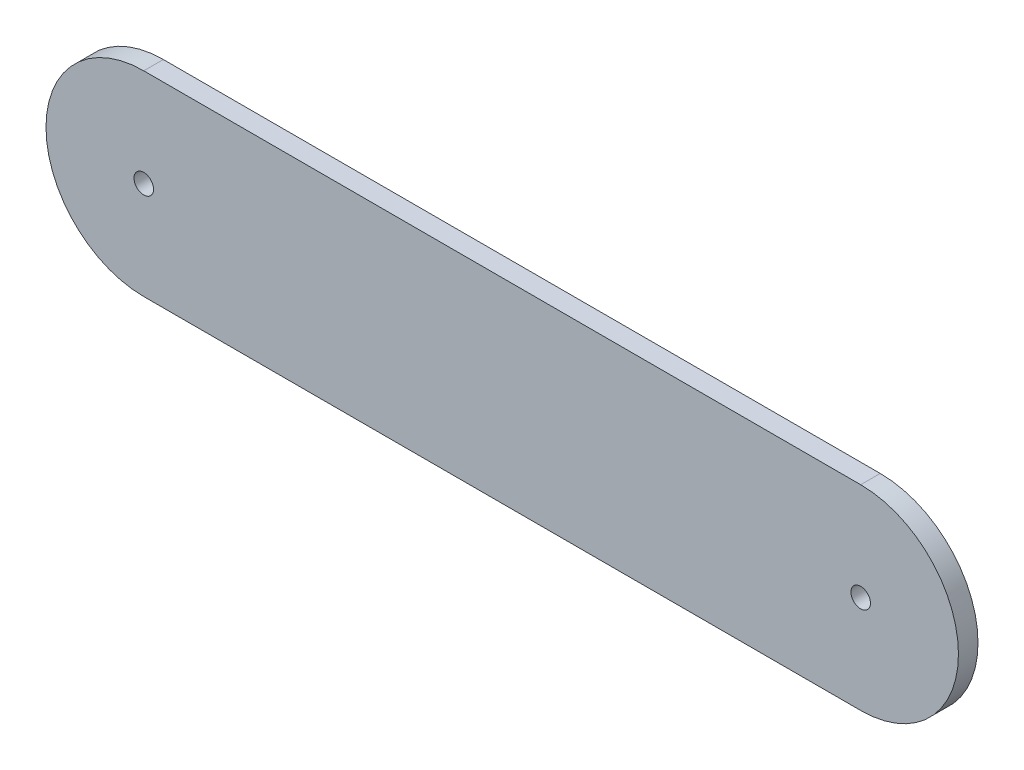
from build123d import *

# Parameters (mm, degrees)
SKETCH1_R           = 1.5
BOSS_EXTRUDE1_DEPTH = 3


with BuildPart() as part:
    # Sketch1 → Boss-Extrude1 (new body)
    with BuildSketch(Plane.XY):
        with BuildLine():
            Line((-132.364555611, 29.763538343), (-22.364555611, 29.763538343))
            ThreePointArc((-22.364555611, 29.763538343), (-7.364555611, 14.763538343), (-22.364555611, -0.236461657))
            Line((-22.364555611, -0.236461657), (-132.364555611, -0.236461657))
            ThreePointArc((-132.364555611, -0.236461657), (-147.364555611, 14.763538343), (-132.364555611, 29.763538343))
        make_face()
        with Locations((-22.364555611, 14.763538343)):
            Circle(SKETCH1_R, mode=Mode.SUBTRACT)
        with Locations((-132.364555611, 14.763538343)):
            Circle(SKETCH1_R, mode=Mode.SUBTRACT)
    extrude(amount=BOSS_EXTRUDE1_DEPTH)


solid = part.part
